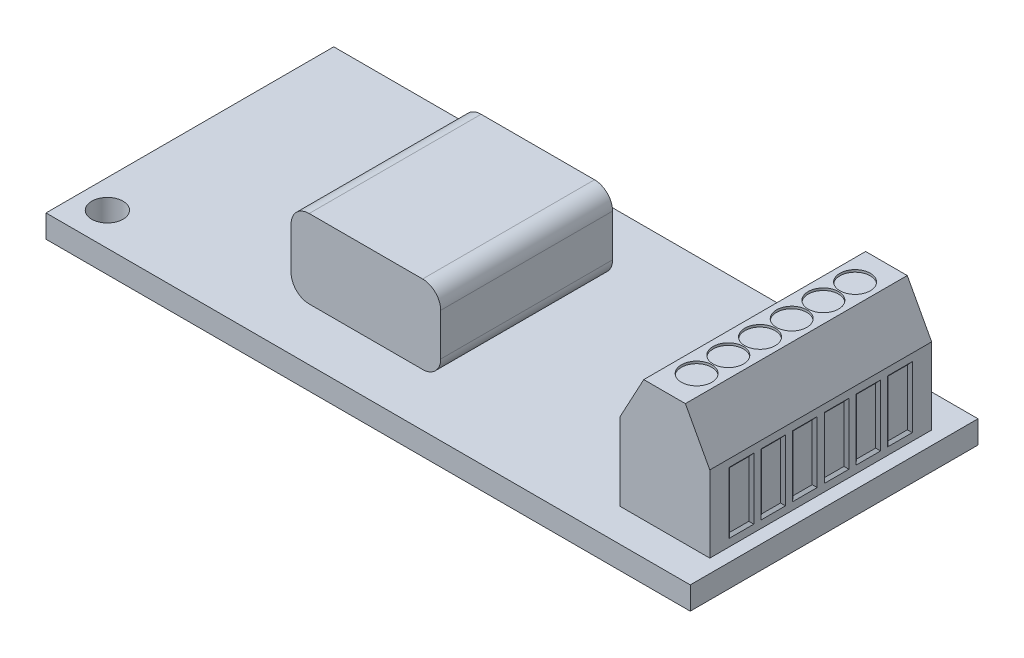
from build123d import *

# Parameters (mm, degrees)
SKETCH1_W                    = 45.212
SKETCH1_H                    = 20.193
BOSS_EXTRUDE1_DEPTH          = 0.8001
SKETCH2_W                    = 6.2992
SKETCH2_H                    = 15.5702
BOSS_EXTRUDE2_DEPTH          = 8.5344
SKETCH6_R                    = 1.1
CUT_EXTRUDE4_DEPTH           = 27.187908118
SKETCH7_W                    = 10.5
SKETCH7_H                    = 12.063
BOSS_EXTRUDE3_DEPTH          = 5.5
CUT_EXTRUDE5_DEPTH           = 31.297124365
SKETCH4_R                    = 1.0668
CUT_EXTRUDE6_DEPTH           = 0.15875
SKETCH5_W                    = 1.7272
SKETCH5_H                    = 4.318
CUT_EXTRUDE7_DEPTH           = 0.15875
CUT_EXTRUDE7_DRAFT           = -50
CUT_EXTRUDE7_PROFILE_2_DEPTH = 0.15875
CUT_EXTRUDE7_PROFILE_2_DRAFT = -50
CUT_EXTRUDE7_PROFILE_3_DEPTH = 0.15875
CUT_EXTRUDE7_PROFILE_3_DRAFT = -50
CUT_EXTRUDE7_PROFILE_4_DEPTH = 0.15875
CUT_EXTRUDE7_PROFILE_4_DRAFT = -50
CUT_EXTRUDE7_PROFILE_5_DEPTH = 0.15875
CUT_EXTRUDE7_PROFILE_5_DRAFT = -50
CUT_EXTRUDE7_PROFILE_6_DEPTH = 0.15875
CUT_EXTRUDE7_PROFILE_6_DRAFT = -50
FILLET1_R                    = 1.27
SKETCH8_W                    = 5
SKETCH8_H                    = 5
BOSS_EXTRUDE4_DEPTH          = 2.17


with BuildPart() as part:
    # Sketch1 → Boss-Extrude1 (new, symmetric)
    with BuildSketch(Plane(origin=(0, 0, 0), x_dir=(1, 0, 0), z_dir=(0, 1, 0))):
        Rectangle(SKETCH1_W, SKETCH1_H)
    extrude(amount=BOSS_EXTRUDE1_DEPTH, both=True)

    # Sketch6 → Cut-Extrude4 (cut, through all)
    with BuildSketch(Plane(origin=(0, 0.8001, 0), x_dir=(1, 0, 0), z_dir=(0, 1, 0))):
        with Locations((-20.617, -7.7773)):
            Circle(SKETCH6_R)
        with Locations((11.806, 7.7465)):
            Circle(SKETCH6_R)
    extrude(amount=-CUT_EXTRUDE4_DEPTH, mode=Mode.SUBTRACT)


with BuildPart() as body_2:
    # Sketch2 → Boss-Extrude2 (new body)
    with BuildSketch(Plane(origin=(0, 0.8001, 0), x_dir=(1, 0, 0), z_dir=(0, 1, 0))):
        with Locations((18.5166, 0)):
            Rectangle(SKETCH2_W, SKETCH2_H)
    extrude(amount=BOSS_EXTRUDE2_DEPTH)

    # Sketch3 → Cut-Extrude5 (cut, through all)
    with BuildSketch(Plane.XY.offset(7.7851)):
        Polygon((17.031947663, 9.3345), (19.952947663, 9.3345), (21.6662, 6.1595), (21.6662, 11.226261879), (15.318695326, 11.226261879), (15.318695326, 6.1595), align=None)
    extrude(amount=-CUT_EXTRUDE5_DEPTH, mode=Mode.SUBTRACT)

    # Sketch4 → Cut-Extrude6 (cut)
    with BuildSketch(Plane(origin=(0, 9.3345, 0), x_dir=(1, 0, 0), z_dir=(0, 1, 0))):
        with Locations((18.5166, -5.560785714)):
            Circle(SKETCH4_R)
        with Locations((18.5166, -3.336471429)):
            Circle(SKETCH4_R)
        with Locations((18.5166, -1.112157143)):
            Circle(SKETCH4_R)
        with Locations((18.5166, 1.112157143)):
            Circle(SKETCH4_R)
        with Locations((18.5166, 3.336471429)):
            Circle(SKETCH4_R)
        with Locations((18.5166, 5.560785714)):
            Circle(SKETCH4_R)
    extrude(amount=-CUT_EXTRUDE6_DEPTH, mode=Mode.SUBTRACT)


with BuildPart() as body_3:
    # Sketch7 → Boss-Extrude3 (new body)
    with BuildSketch(Plane(origin=(0, 0.8001, 0), x_dir=(1, 0, 0), z_dir=(0, 1, 0))):
        with Locations((-3.856, -0.365)):
            Rectangle(SKETCH7_W, SKETCH7_H)
    extrude(amount=BOSS_EXTRUDE3_DEPTH)

    # Fillet1
    fillet1_edges = [body_3.edges().sort_by_distance(p)[0] for p in [
        (-9.106, 0.8001, 0.365),
        (-9.106, 6.3001, 0.365),
        (1.394, 6.3001, 0.365),
        (1.394, 0.8001, 0.365),
    ]]
    fillet(fillet1_edges, radius=FILLET1_R)


with BuildPart() as cut_extrude7_tool:
    # Sketch5 → Cut-Extrude7 (with draft: the straight prism first)
    with BuildSketch(Plane(origin=(21.6662, 0, 0), x_dir=(0, 0, -1), z_dir=(1, 0, 0))):
        with Locations((-5.560785714, 3.4798)):
            Rectangle(SKETCH5_W, SKETCH5_H)
    extrude(amount=-CUT_EXTRUDE7_DEPTH)
    # Cut-Extrude7: the draft: its side faces are tilted about the plane it starts from
    cut_extrude7_sides = [cut_extrude7_tool.faces().sort_by_distance(p)[0] for p in [
        (21.586825, 1.3208, 5.560785714),
        (21.586825, 3.4798, 4.697185714),
        (21.586825, 5.6388, 5.560785714),
        (21.586825, 3.4798, 6.424385714),
    ]]
    draft(cut_extrude7_sides, Plane(origin=(21.6662, 0, 0), x_dir=(0, 0, -1), z_dir=(1, 0, 0)), CUT_EXTRUDE7_DRAFT)


with BuildPart() as body_2_1:
    add(body_2.part)

    # Cut-Extrude7: cut by cut_extrude7_tool
    add(cut_extrude7_tool.part, mode=Mode.SUBTRACT)


with BuildPart() as cut_extrude7_profile_2_tool:
    # Sketch5 → Cut-Extrude7 profile 2 (with draft: the straight prism first)
    with BuildSketch(Plane(origin=(21.6662, 0, 0), x_dir=(0, 0, -1), z_dir=(1, 0, 0))):
        with Locations((-3.336471429, 3.4798)):
            Rectangle(SKETCH5_W, SKETCH5_H)
    extrude(amount=-CUT_EXTRUDE7_PROFILE_2_DEPTH)
    # Cut-Extrude7 profile 2: the draft: its side faces are tilted about the plane it starts from
    cut_extrude7_profile_2_sides = [cut_extrude7_profile_2_tool.faces().sort_by_distance(p)[0] for p in [
        (21.586825, 1.3208, 3.336471429),
        (21.586825, 3.4798, 2.472871429),
        (21.586825, 5.6388, 3.336471429),
        (21.586825, 3.4798, 4.200071429),
    ]]
    draft(cut_extrude7_profile_2_sides, Plane(origin=(21.6662, 0, 0), x_dir=(0, 0, -1), z_dir=(1, 0, 0)), CUT_EXTRUDE7_PROFILE_2_DRAFT)


with BuildPart() as body_2_2:
    add(body_2_1.part)

    # Cut-Extrude7 profile 2: cut by cut_extrude7_profile_2_tool
    add(cut_extrude7_profile_2_tool.part, mode=Mode.SUBTRACT)


with BuildPart() as cut_extrude7_profile_3_tool:
    # Sketch5 → Cut-Extrude7 profile 3 (with draft: the straight prism first)
    with BuildSketch(Plane(origin=(21.6662, 0, 0), x_dir=(0, 0, -1), z_dir=(1, 0, 0))):
        with Locations((-1.112157143, 3.4798)):
            Rectangle(SKETCH5_W, SKETCH5_H)
    extrude(amount=-CUT_EXTRUDE7_PROFILE_3_DEPTH)
    # Cut-Extrude7 profile 3: the draft: its side faces are tilted about the plane it starts from
    cut_extrude7_profile_3_sides = [cut_extrude7_profile_3_tool.faces().sort_by_distance(p)[0] for p in [
        (21.586825, 1.3208, 1.112157143),
        (21.586825, 3.4798, 0.248557143),
        (21.586825, 5.6388, 1.112157143),
        (21.586825, 3.4798, 1.975757143),
    ]]
    draft(cut_extrude7_profile_3_sides, Plane(origin=(21.6662, 0, 0), x_dir=(0, 0, -1), z_dir=(1, 0, 0)), CUT_EXTRUDE7_PROFILE_3_DRAFT)


with BuildPart() as body_2_3:
    add(body_2_2.part)

    # Cut-Extrude7 profile 3: cut by cut_extrude7_profile_3_tool
    add(cut_extrude7_profile_3_tool.part, mode=Mode.SUBTRACT)


with BuildPart() as cut_extrude7_profile_4_tool:
    # Sketch5 → Cut-Extrude7 profile 4 (with draft: the straight prism first)
    with BuildSketch(Plane(origin=(21.6662, 0, 0), x_dir=(0, 0, -1), z_dir=(1, 0, 0))):
        with Locations((1.112157143, 3.4798)):
            Rectangle(SKETCH5_W, SKETCH5_H)
    extrude(amount=-CUT_EXTRUDE7_PROFILE_4_DEPTH)
    # Cut-Extrude7 profile 4: the draft: its side faces are tilted about the plane it starts from
    cut_extrude7_profile_4_sides = [cut_extrude7_profile_4_tool.faces().sort_by_distance(p)[0] for p in [
        (21.586825, 1.3208, -1.112157143),
        (21.586825, 3.4798, -1.975757143),
        (21.586825, 5.6388, -1.112157143),
        (21.586825, 3.4798, -0.248557143),
    ]]
    draft(cut_extrude7_profile_4_sides, Plane(origin=(21.6662, 0, 0), x_dir=(0, 0, -1), z_dir=(1, 0, 0)), CUT_EXTRUDE7_PROFILE_4_DRAFT)


with BuildPart() as body_2_4:
    add(body_2_3.part)

    # Cut-Extrude7 profile 4: cut by cut_extrude7_profile_4_tool
    add(cut_extrude7_profile_4_tool.part, mode=Mode.SUBTRACT)


with BuildPart() as cut_extrude7_profile_5_tool:
    # Sketch5 → Cut-Extrude7 profile 5 (with draft: the straight prism first)
    with BuildSketch(Plane(origin=(21.6662, 0, 0), x_dir=(0, 0, -1), z_dir=(1, 0, 0))):
        with Locations((5.560785714, 3.4798)):
            Rectangle(SKETCH5_W, SKETCH5_H)
    extrude(amount=-CUT_EXTRUDE7_PROFILE_5_DEPTH)
    # Cut-Extrude7 profile 5: the draft: its side faces are tilted about the plane it starts from
    cut_extrude7_profile_5_sides = [cut_extrude7_profile_5_tool.faces().sort_by_distance(p)[0] for p in [
        (21.586825, 1.3208, -5.560785714),
        (21.586825, 3.4798, -6.424385714),
        (21.586825, 5.6388, -5.560785714),
        (21.586825, 3.4798, -4.697185714),
    ]]
    draft(cut_extrude7_profile_5_sides, Plane(origin=(21.6662, 0, 0), x_dir=(0, 0, -1), z_dir=(1, 0, 0)), CUT_EXTRUDE7_PROFILE_5_DRAFT)


with BuildPart() as body_2_5:
    add(body_2_4.part)

    # Cut-Extrude7 profile 5: cut by cut_extrude7_profile_5_tool
    add(cut_extrude7_profile_5_tool.part, mode=Mode.SUBTRACT)


with BuildPart() as cut_extrude7_profile_6_tool:
    # Sketch5 → Cut-Extrude7 profile 6 (with draft: the straight prism first)
    with BuildSketch(Plane(origin=(21.6662, 0, 0), x_dir=(0, 0, -1), z_dir=(1, 0, 0))):
        with Locations((3.336471429, 3.4798)):
            Rectangle(SKETCH5_W, SKETCH5_H)
    extrude(amount=-CUT_EXTRUDE7_PROFILE_6_DEPTH)
    # Cut-Extrude7 profile 6: the draft: its side faces are tilted about the plane it starts from
    cut_extrude7_profile_6_sides = [cut_extrude7_profile_6_tool.faces().sort_by_distance(p)[0] for p in [
        (21.586825, 1.3208, -3.336471429),
        (21.586825, 3.4798, -4.200071429),
        (21.586825, 5.6388, -3.336471429),
        (21.586825, 3.4798, -2.472871429),
    ]]
    draft(cut_extrude7_profile_6_sides, Plane(origin=(21.6662, 0, 0), x_dir=(0, 0, -1), z_dir=(1, 0, 0)), CUT_EXTRUDE7_PROFILE_6_DRAFT)


with BuildPart() as body_2_6:
    add(body_2_5.part)

    # Cut-Extrude7 profile 6: cut by cut_extrude7_profile_6_tool
    add(cut_extrude7_profile_6_tool.part, mode=Mode.SUBTRACT)


with BuildPart() as body_4:
    # Sketch8 → Boss-Extrude4 (new body)
    with BuildSketch(Plane.XZ.offset(0.8001)):
        with Locations((6.606, -6.921204961)):
            Rectangle(SKETCH8_W, SKETCH8_H)
    extrude(amount=BOSS_EXTRUDE4_DEPTH)


solid = Compound([part.part, body_3.part, body_2_6.part, body_4.part])
